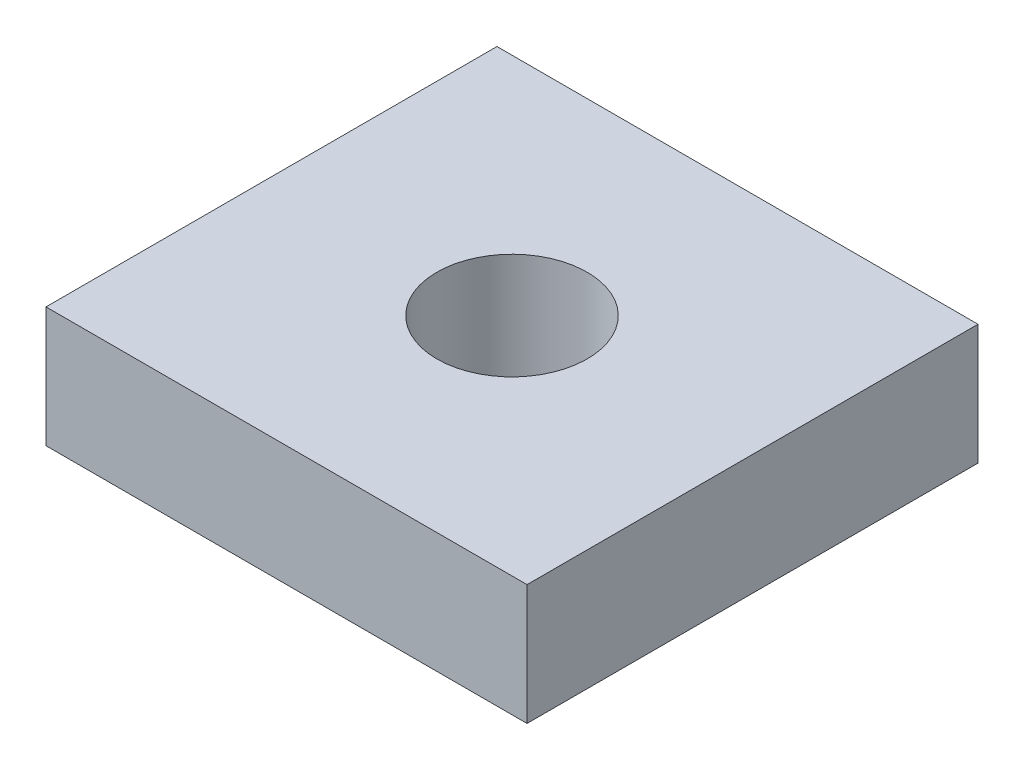
from build123d import *

# Parameters (mm, degrees)
IZIM1_W                     = 16
IZIM1_H                     = 15
IZIM1_R                     = 2.5
Y_KSEKLIK_EKSTR_ZYON1_DEPTH = 4


with BuildPart() as part:
    # Çizim1 → Yükseklik-Ekstrüzyon1 (new body)
    with BuildSketch(Plane(origin=(0, 0, 0), x_dir=(1, 0, 0), z_dir=(0, 1, 0))):
        Rectangle(IZIM1_W, IZIM1_H)
        with Locations(Location((0, 0, 0), (0, 0, 270))):
            Circle(IZIM1_R, mode=Mode.SUBTRACT)
    extrude(amount=Y_KSEKLIK_EKSTR_ZYON1_DEPTH)


solid = part.part
